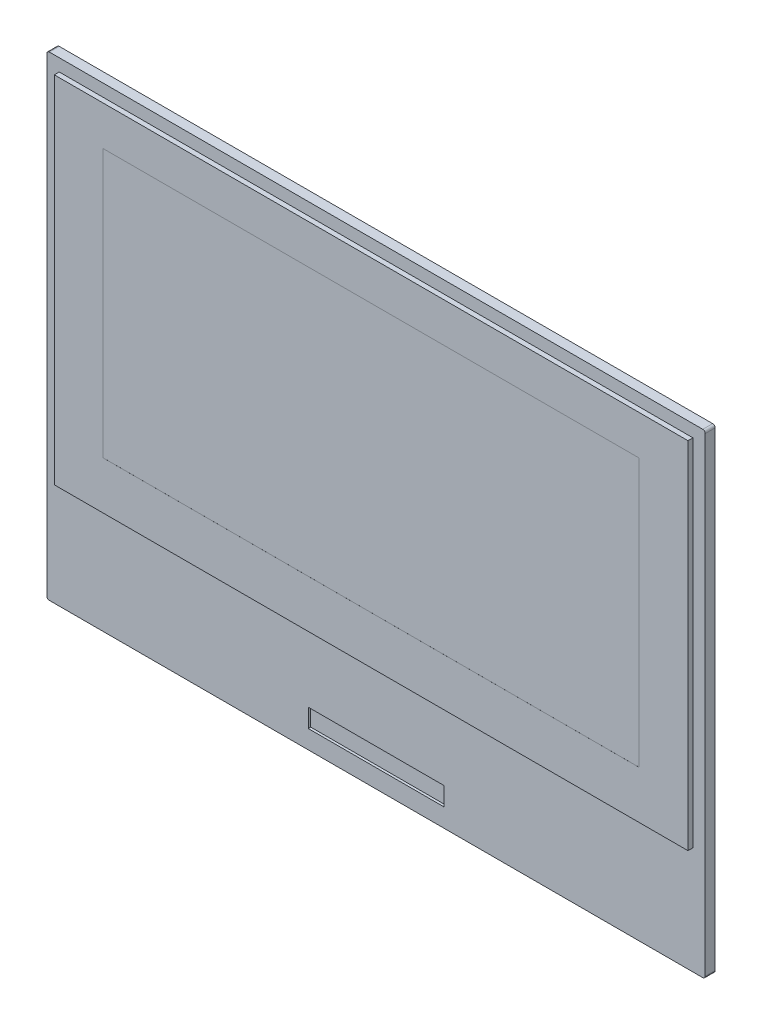
from build123d import *

# Parameters (mm, degrees)
SKETCH3_W           = 26.7
SKETCH3_H           = 19.26
BOSS_EXTRUDE1_DEPTH = 0.4
SKETCH5_W           = 25.7
SKETCH5_H           = 14.4
BOSS_EXTRUDE3_DEPTH = 0.2
SKETCH6_W           = 21.744
SKETCH6_H           = 10.864
CUT_EXTRUDE1_DEPTH  = 0.001
FILLET1_R           = 0.1
SKETCH7_W           = 5.5
SKETCH7_H           = 0.75
CUT_EXTRUDE2_DEPTH  = 0.1
SKETCH8_W           = 5.5
SKETCH8_H           = 0.75
CUT_EXTRUDE3_DEPTH  = 0.1


with BuildPart() as part:
    # Sketch3 → Boss-Extrude1 (new body)
    with BuildSketch(Plane.XY):
        Rectangle(SKETCH3_W, SKETCH3_H)
    extrude(amount=-BOSS_EXTRUDE1_DEPTH)

    # Sketch5 → Boss-Extrude3 (add)
    with BuildSketch(Plane.XY):
        with Locations((0, 1.93)):
            Rectangle(SKETCH5_W, SKETCH5_H)
    extrude(amount=BOSS_EXTRUDE3_DEPTH)

    # Sketch6 → Cut-Extrude1 (cut)
    with BuildSketch(Plane.XY.offset(0.2)):
        with Locations((0, 2.098)):
            Rectangle(SKETCH6_W, SKETCH6_H)
    extrude(amount=-CUT_EXTRUDE1_DEPTH, mode=Mode.SUBTRACT)

    # Fillet1
    fillet1_edges = [part.edges().sort_by_distance(p)[0] for p in [
        (13.35, -9.63, -0.2),
        (-13.35, -9.63, -0.2),
        (-13.35, 9.63, -0.2),
        (13.35, 9.63, -0.2),
    ]]
    fillet(fillet1_edges, radius=FILLET1_R)

    # Sketch7 → Cut-Extrude2 (cut)
    with BuildSketch(Plane.XY):
        with Locations((0, -8.505)):
            Rectangle(SKETCH7_W, SKETCH7_H)
    extrude(amount=-CUT_EXTRUDE2_DEPTH, mode=Mode.SUBTRACT)

    # Sketch8 → Cut-Extrude3 (cut)
    with BuildSketch(Plane(origin=(0, 0, -0.4), x_dir=(-1, 0, 0), z_dir=(0, 0, -1))):
        with Locations((0, -8.505)):
            Rectangle(SKETCH8_W, SKETCH8_H)
    extrude(amount=-CUT_EXTRUDE3_DEPTH, mode=Mode.SUBTRACT)


solid = part.part
